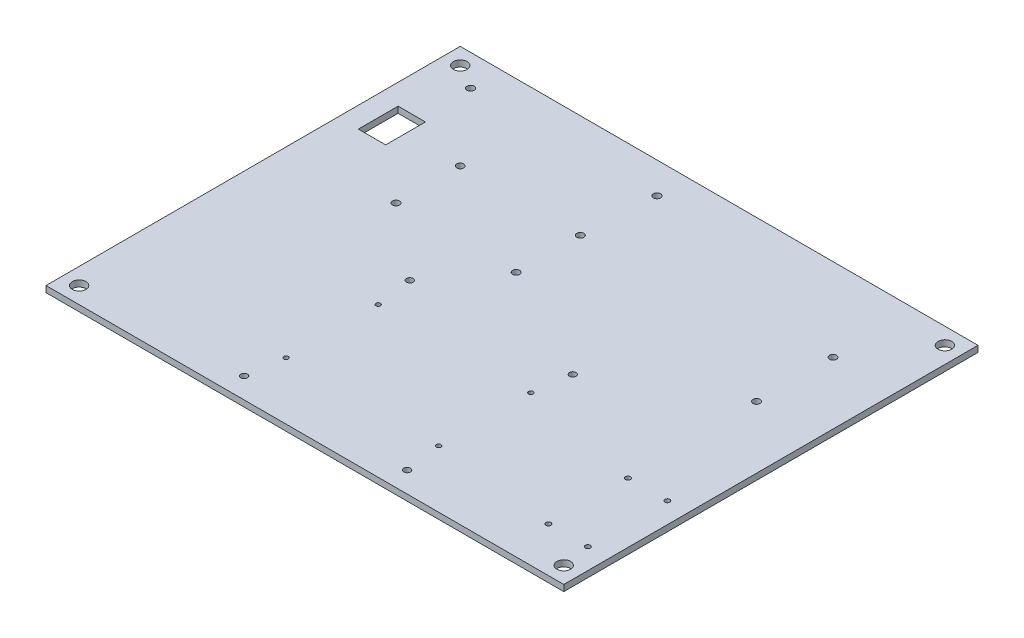
from build123d import *

# Parameters (mm, degrees)
SKETCH2_W           = 250
SKETCH2_H           = 200
BOSS_EXTRUDE2_DEPTH = 3
SKETCH3_R           = 1.75
SKETCH3_R_2         = 3.3
SKETCH3_R_3         = 1.7
SKETCH3_R_4         = 1.2
SKETCH3_R_5         = 1.6
SKETCH3_R_6         = 1.1
SKETCH3_W           = 13.2
SKETCH3_H           = 19.2
CUT_EXTRUDE1_DEPTH  = 3


with BuildPart() as part:
    # Sketch2 → Boss-Extrude2 (new body)
    with BuildSketch(Plane(origin=(0, 0, 0), x_dir=(1, 0, 0), z_dir=(0, 1, 0))):
        Rectangle(SKETCH2_W, SKETCH2_H)
    extrude(amount=BOSS_EXTRUDE2_DEPTH)

    # Sketch3 → Cut-Extrude1 (cut)
    with BuildSketch(Plane(origin=(0, 3, 0), x_dir=(1, 0, 0), z_dir=(0, 1, 0))):
        with Locations(Location((-105, 85, 0), (0, 0, 270))):
            Circle(SKETCH3_R)
        with Locations(Location((-15, 85, 0), (0, 0, 270))):
            Circle(SKETCH3_R)
        with Locations(Location((-117, 92, 0), (0, 0, 270))):
            Circle(SKETCH3_R_2)
        with Locations(Location((-117, -92, 0), (0, 0, 90))):
            Circle(SKETCH3_R_2)
        with Locations(Location((117, 92, 0), (0, 0, 90))):
            Circle(SKETCH3_R_2)
        with Locations(Location((117, -92, 0), (0, 0, 270))):
            Circle(SKETCH3_R_2)
        with Locations(Location((-75, 50, 0), (0, 0, 270))):
            Circle(SKETCH3_R_3)
        with Locations(Location((-17, 50, 0), (0, 0, 270))):
            Circle(SKETCH3_R_3)
        with Locations(Location((-75, 19, 0), (0, 0, 270))):
            Circle(SKETCH3_R_3)
        with Locations(Location((-17, 19, 0), (0, 0, 270))):
            Circle(SKETCH3_R_3)
        with Locations(Location((95, 60, 0), (0, 0, 270))):
            Circle(SKETCH3_R_3)
        with Locations(Location((95, 23.07, 0), (0, 0, 270))):
            Circle(SKETCH3_R_3)
        with Locations(Location((96, -40, 0), (0, 0, 270))):
            Circle(SKETCH3_R_4)
        with Locations(Location((115, -40, 0), (0, 0, 270))):
            Circle(SKETCH3_R_4)
        with Locations(Location((115, -78.4, 0), (0, 0, 270))):
            Circle(SKETCH3_R_4)
        with Locations(Location((96, -78.4, 0), (0, 0, 270))):
            Circle(SKETCH3_R_4)
        with Locations(Location((-39.35, -10, 0), (0, 0, 270))):
            Circle(SKETCH3_R_5)
        with Locations(Location((39.35, -10, 0), (0, 0, 270))):
            Circle(SKETCH3_R_5)
        with Locations(Location((-39.35, -90, 0), (0, 0, 270))):
            Circle(SKETCH3_R_5)
        with Locations(Location((39.35, -90, 0), (0, 0, 270))):
            Circle(SKETCH3_R_5)
        with Locations(Location((-36.85, -27.75, 0), (0, 0, 270))):
            Circle(SKETCH3_R_6)
        with Locations(Location((36.85, -27.75, 0), (0, 0, 270))):
            Circle(SKETCH3_R_6)
        with Locations(Location((36.85, -72.25, 0), (0, 0, 270))):
            Circle(SKETCH3_R_6)
        with Locations(Location((-36.85, -72.25, 0), (0, 0, 270))):
            Circle(SKETCH3_R_6)
        with Locations((-108.4, 50.4)):
            Rectangle(SKETCH3_W, SKETCH3_H)
    extrude(amount=-CUT_EXTRUDE1_DEPTH, mode=Mode.SUBTRACT)


solid = part.part
